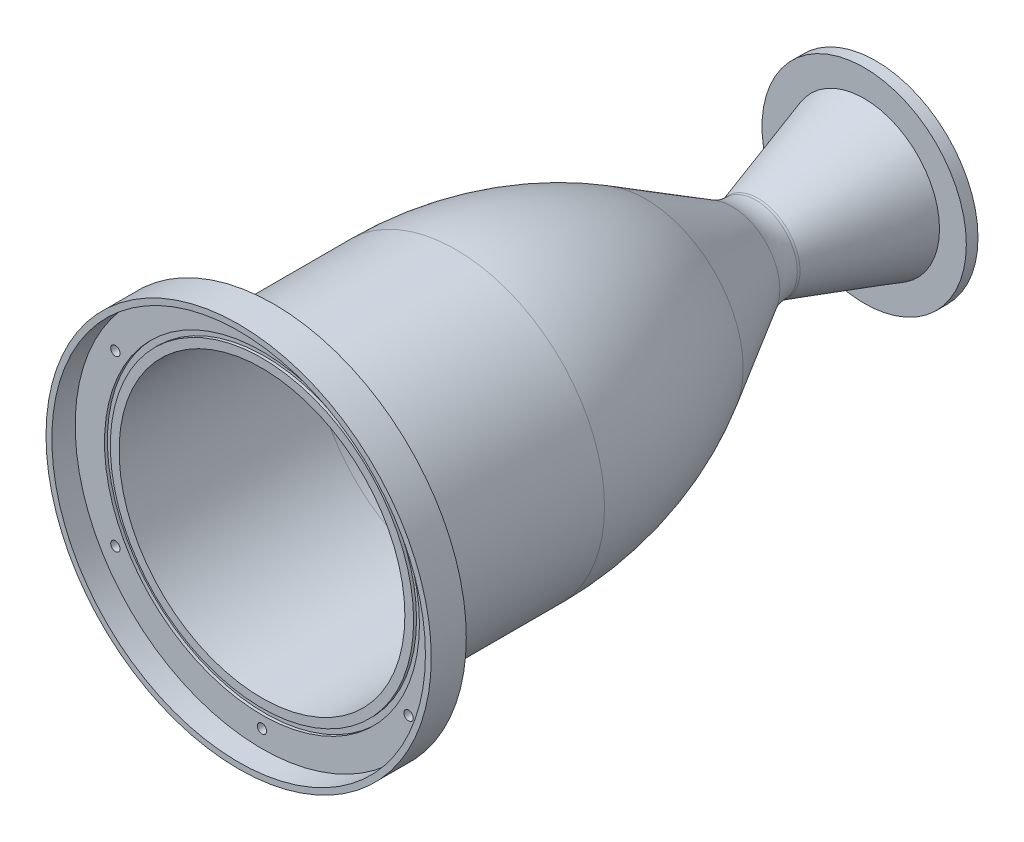
from build123d import *

# Parameters (mm, degrees)
M2X0_4_TAPPED_HOLE1_D = 1.6
CIRPATTERN1_COUNT     = 6
SKETCH7_W             = 0.5
SKETCH7_H             = 1


with BuildPart() as part:
    # Sketch3 → Main Base (revolve)
    with BuildSketch(Plane(origin=(0, 0, 0), x_dir=(0, 0, -1), z_dir=(1, 0, 0)), mode=Mode.PRIVATE) as main_base_sk:
        with BuildLine():
            Line((0, 24.479181), (33.202143, 24.47918))
            ThreePointArc((33.202143, 24.47918), (49.748007926, 22.300875558), (65.1662995, 15.914410079))
            Line((65.1662995, 15.914410079), (80.000916, 7.349641))
            ThreePointArc((80.000916, 7.349641), (82.214883341, 6.432585552), (84.590763, 6.119795))
            ThreePointArc((84.590763, 6.119795), (84.954745401, 6.148304311), (85.309850177, 6.233136896))
            add(Edge.make_bspline(
                [(85.309850177, 6.233136896), (101.510458516, 11.470300103), (105.161240485, 12.486702482)],
                knots=[0, 0, 0, 1, 1, 1], degree=2))
            Line((105.161240485, 12.486702482), (105.161240485, 17.5))
            Line((105.161240485, 17.5), (103.161240485, 17.5))
            Line((103.161240485, 17.5), (103.161240485, 12.905109467))
            Line((103.161240485, 12.905109467), (84.9926914, 7.181670879))
            ThreePointArc((84.9926914, 7.181670879), (84.794089673, 7.135403418), (84.590762984, 7.119860535))
            ThreePointArc((84.590762984, 7.119860535), (82.473734699, 7.398570567), (80.500976308, 8.215707259))
            Line((80.500976308, 8.215707259), (65.666086023, 16.780559888))
            ThreePointArc((65.666086023, 16.780559888), (50.0067079, 23.266834324), (33.202143, 25.479181))
            Line((33.202143, 25.479181), (2, 25.479181))
            Line((2, 25.479181), (2, 33))
            Line((2, 33), (-4, 33))
            Line((-4, 33), (-4, 32))
            Line((-4, 32), (0, 32))
            Line((0, 32), (0, 24.479181))
        make_face()
    revolve(main_base_sk.sketch.rotate(Axis((0, 0, 0), (0, 0, -1)), 90), axis=Axis((0, 0, 0), (0, 0, -1)))

    # M2x0.4 Tapped Hole1 (through all)
    with Locations(Plane.XY):
        with Locations((0, 29)):
            m2x0_4_tapped_hole1 = Hole(M2X0_4_TAPPED_HOLE1_D / 2)

    # CirPattern1: M2x0.4 Tapped Hole1 ×6 about axis
    cirpattern1_axis = Axis((0, 0, 0), (0, 0, 1))
    for i in range(1, CIRPATTERN1_COUNT):
        add(m2x0_4_tapped_hole1.rotate(cirpattern1_axis, i * 360 / CIRPATTERN1_COUNT), mode=Mode.SUBTRACT)

    # Sketch7 → Face O-Ring (revolve, cut)
    with BuildSketch(Plane(origin=(0, 0, 0), x_dir=(0, 0, -1), z_dir=(1, 0, 0)), mode=Mode.PRIVATE) as face_o_ring_sk:
        with Locations((0.25, 26.4791805)):
            Rectangle(SKETCH7_W, SKETCH7_H)
    revolve(face_o_ring_sk.sketch.rotate(Axis((0, 0, 2.686094), (0, 0, -1)), 90), axis=Axis((0, 0, 2.686094), (0, 0, -1)), mode=Mode.SUBTRACT)


solid = part.part
